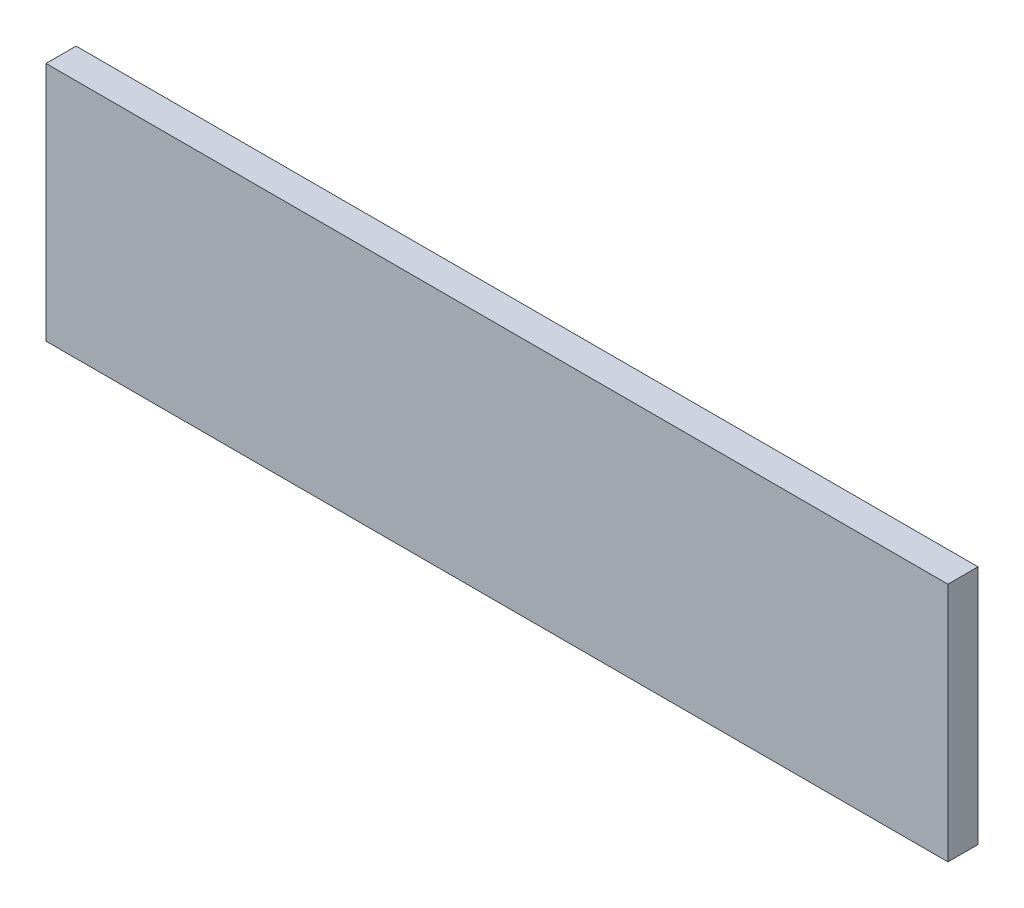
from build123d import *

# Parameters (mm, degrees)
SKETCH1_W           = 300
SKETCH1_H           = 80
BOSS_EXTRUDE1_DEPTH = 10


with BuildPart() as part:
    # Sketch1 → Boss-Extrude1 (new body)
    with BuildSketch(Plane.XY):
        Rectangle(SKETCH1_W, SKETCH1_H)
    extrude(amount=BOSS_EXTRUDE1_DEPTH)


solid = part.part
